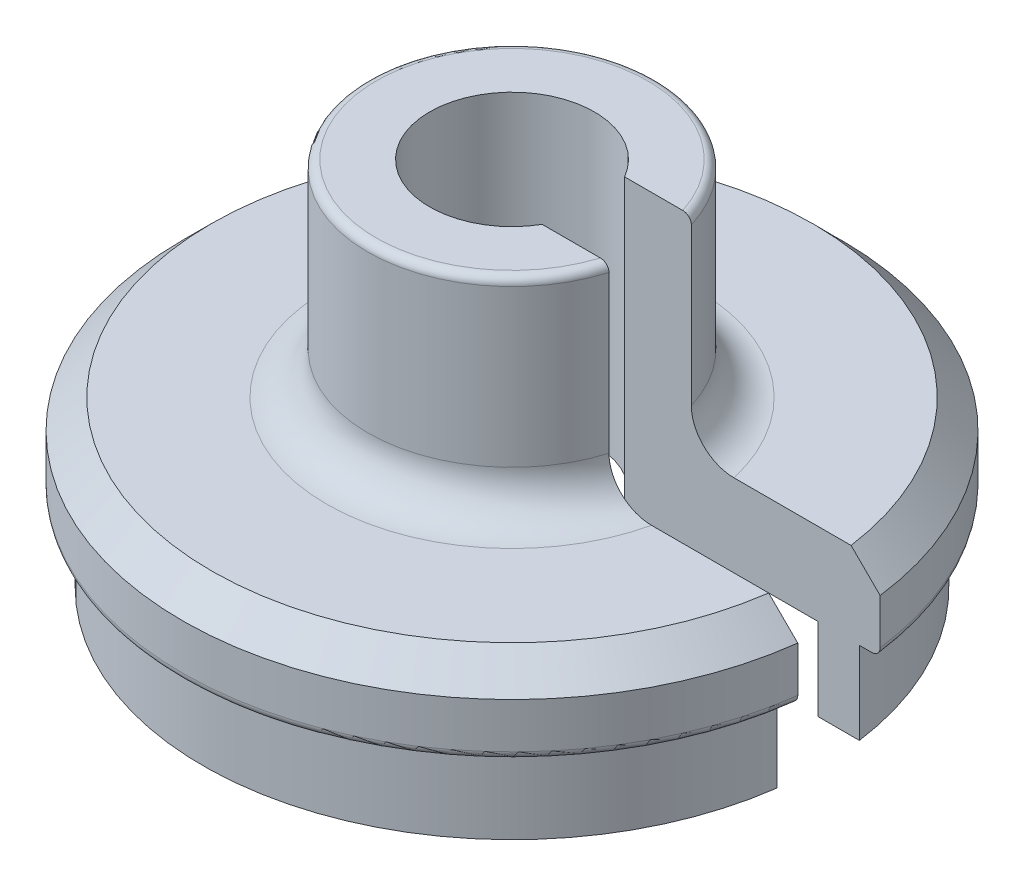
from build123d import *

# Parameters (mm, degrees)
SKETCH_2_W          = 9.419019416
SKETCH_2_H          = 11.792672783
CUT_EXTRUDE_1_DEPTH = 1
FILLET_1_R          = 0.2
CHAMFER_1_SIZE      = 0.7
FILLET_2_R          = 0.2
FILLET_3_R          = 1
EXTRUDE_1_DEPTH     = 2


with BuildPart() as part:
    # 草图1 → 旋转1 (revolve)
    with BuildSketch(Plane.XY, mode=Mode.PRIVATE) as revolve_1_sk:
        Polygon((-1.596153846, 5), (-0.096153846, 5), (-0.096153846, 0), (4.403846154, 0), (4.403846154, -2), (-1.596153846, -2), align=None)
    revolve(revolve_1_sk.sketch.rotate(Axis((-3.596153846, 17.535042267, 0), (0, -1, 0)), 180), axis=Axis((-3.596153846, 17.535042267, 0), (0, -1, 0)))

    # 草图2 → 切除-拉伸1 (cut, symmetric)
    with BuildSketch(Plane.XY):
        with Locations((1.113355862, -0.208425672)):
            Rectangle(SKETCH_2_W, SKETCH_2_H)
    extrude(amount=CUT_EXTRUDE_1_DEPTH, both=True, mode=Mode.SUBTRACT)

    # 圆角1
    fillet_1_edges = [part.edges().sort_by_distance(p)[0] for p in [
        (-7.096153846, 5, 0),
    ]]
    fillet(fillet_1_edges, radius=FILLET_1_R)

    # 倒角1
    chamfer_1_edges = [part.edges().sort_by_distance(p)[0] for p in [
        (-11.596153846, 0, 0),
    ]]
    chamfer(chamfer_1_edges, length=CHAMFER_1_SIZE)

    # 圆角2
    fillet_2_edges = [part.edges().sort_by_distance(p)[0] for p in [
        (-11.596153846, -2, 0),
    ]]
    fillet(fillet_2_edges, radius=FILLET_2_R)

    # 圆角3
    fillet_3_edges = [part.edges().sort_by_distance(p)[0] for p in [
        (-7.096153846, 0, 0),
    ]]
    fillet(fillet_3_edges, radius=FILLET_3_R)

    # 草图3 → 凸台-拉伸1 (add)
    with BuildSketch(Plane.XZ.offset(2)):
        with BuildLine():
            Line((2.826462443, -1), (3.836880528, -1))
            ThreePointArc((3.836880528, -1), (-11.096153846, 0), (3.836880528, 1))
            Line((3.836880528, 1), (2.826462443, 1))
            ThreePointArc((2.826462443, 1), (-10.096153846, 0), (2.826462443, -1))
        make_face()
    extrude(amount=EXTRUDE_1_DEPTH)


solid = part.part
